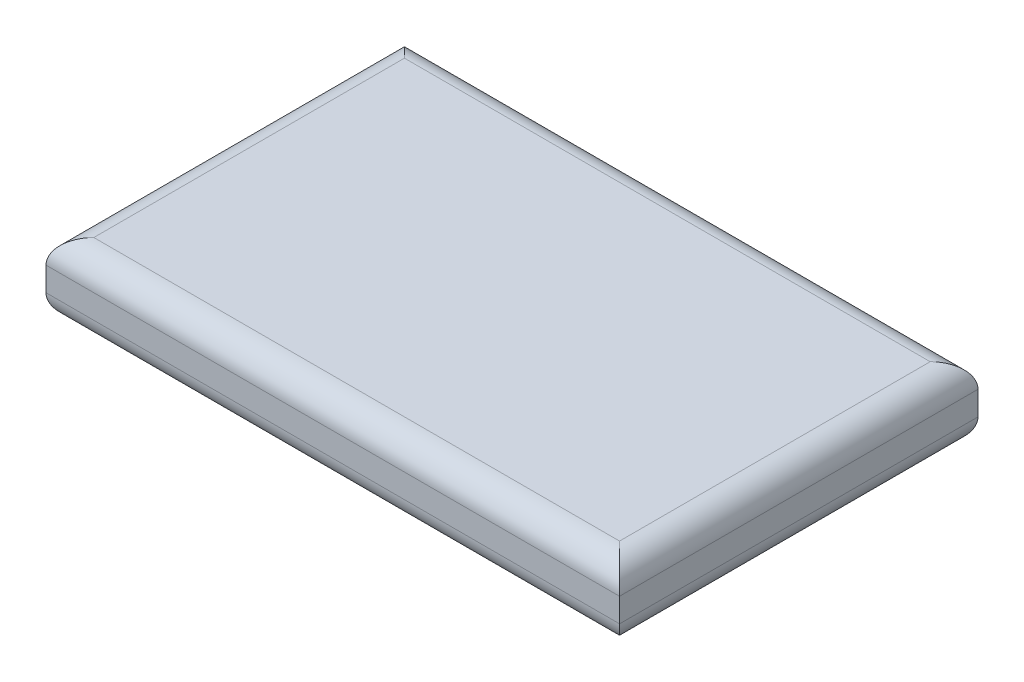
from build123d import *

# Parameters (mm, degrees)
SKETCH1_W           = 48
SKETCH1_H           = 30
BOSS_EXTRUDE1_DEPTH = 6
FILLET1_R           = 2


with BuildPart() as part:
    # Sketch1 → Boss-Extrude1 (new body)
    with BuildSketch(Plane(origin=(0, 0, 0), x_dir=(1, 0, 0), z_dir=(0, 1, 0))):
        with Locations((0.12581006, -0.870928549)):
            Rectangle(SKETCH1_W, SKETCH1_H)
    extrude(amount=BOSS_EXTRUDE1_DEPTH)

    # Fillet1
    fillet1_edges = [part.edges().sort_by_distance(p)[0] for p in [
        (-23.87418994, 6, 0.870928549),
        (0.12581006, 6, 15.870928549),
        (24.12581006, 6, 0.870928549),
        (0.12581006, 0, 15.870928549),
        (-23.87418994, 0, 0.870928549),
        (0.12581006, 0, -14.129071451),
        (24.12581006, 0, 0.870928549),
        (0.12581006, 6, -14.129071451),
    ]]
    fillet(fillet1_edges, radius=FILLET1_R)


solid = part.part
